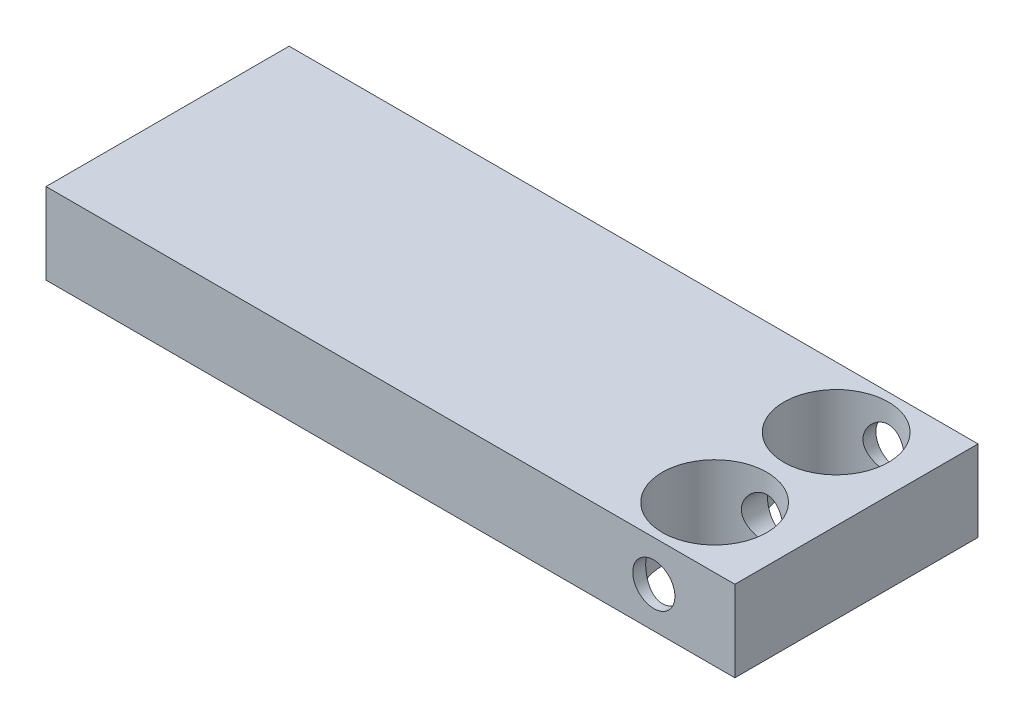
from build123d import *

# Parameters (mm, degrees)
SKETCH1_W           = 85
SKETCH1_H           = 30
SKETCH1_R           = 6.45
BOSS_EXTRUDE1_DEPTH = 10
SKETCH2_R           = 2.6
CUT_EXTRUDE1_DEPTH  = 56.332186294


with BuildPart() as part:
    # Sketch1 → Boss-Extrude1 (new body)
    with BuildSketch(Plane(origin=(0, 0, 0), x_dir=(1, 0, 0), z_dir=(0, 1, 0))):
        with Locations((2.905405405, -7.22972973)):
            Rectangle(SKETCH1_W, SKETCH1_H)
        with Locations(Location((35.405405405, 0.27027027, 0), (0, 0, 270))):
            Circle(SKETCH1_R, mode=Mode.SUBTRACT)
        with Locations(Location((35.405405405, -14.72972973, 0), (0, 0, 270))):
            Circle(SKETCH1_R, mode=Mode.SUBTRACT)
    extrude(amount=BOSS_EXTRUDE1_DEPTH)

    # Sketch2 → Cut-Extrude1 (cut, through all)
    with BuildSketch(Plane.XY.offset(22.22972973)):
        with Locations((35.405405405, 5)):
            Circle(SKETCH2_R)
    extrude(amount=-CUT_EXTRUDE1_DEPTH, mode=Mode.SUBTRACT)


solid = part.part
